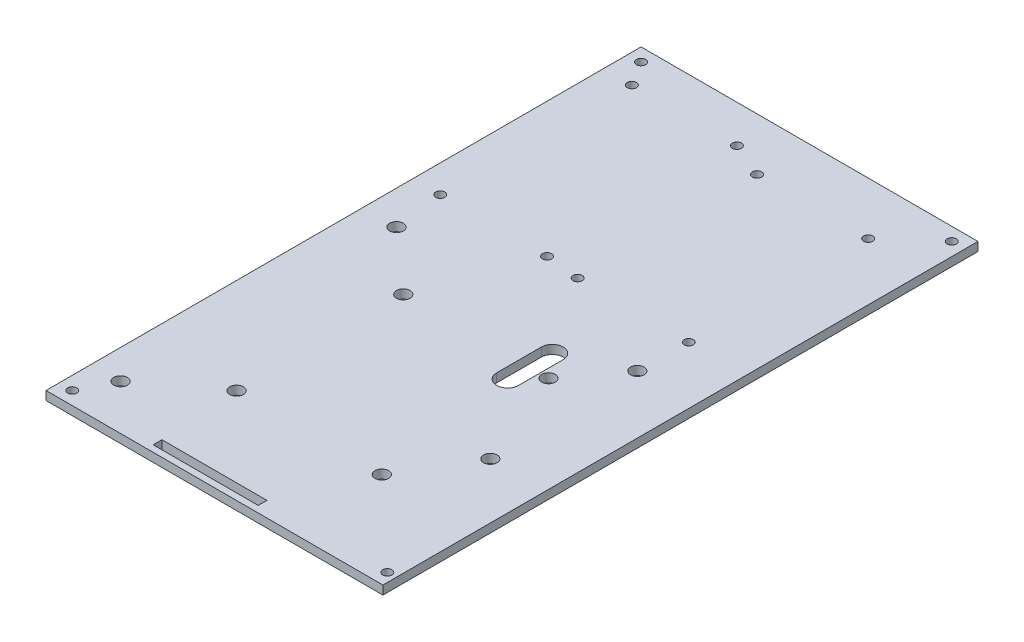
from build123d import *

# Parameters (mm, degrees)
SKETCH_1_W      = 77
SKETCH_1_H      = 136
SKETCH_1_R      = 1.55
SKETCH_1_R_2    = 1.05
SKETCH_1_W_2    = 24
SKETCH_1_H_2    = 2
EXTRUDE_1_DEPTH = 2


with BuildPart() as part:
    # 草图1 → 凸台-拉伸1 (new body)
    with BuildSketch(Plane(origin=(0, 0, 0), x_dir=(1, 0, 0), z_dir=(0, 1, 0))):
        with Locations((38.5, 68)):
            Rectangle(SKETCH_1_W, SKETCH_1_H)
        with Locations(Location((7.71, 72.38, 0), (0, 0, 270))):
            Circle(SKETCH_1_R, mode=Mode.SUBTRACT)
        with Locations(Location((6.71, 10.34, 0), (0, 0, 270))):
            Circle(SKETCH_1_R, mode=Mode.SUBTRACT)
        with Locations(Location((63.71, 71.44, 0), (0, 0, 270))):
            Circle(SKETCH_1_R, mode=Mode.SUBTRACT)
        with Locations(Location((64.31, 37.24, 0), (0, 0, 270))):
            Circle(SKETCH_1_R, mode=Mode.SUBTRACT)
        with Locations(Location((21.81, 21.74, 0), (0, 0, 270))):
            Circle(SKETCH_1_R, mode=Mode.SUBTRACT)
        with Locations(Location((55.01, 21.74, 0), (0, 0, 270))):
            Circle(SKETCH_1_R, mode=Mode.SUBTRACT)
        with Locations(Location((21.81, 59.84, 0), (0, 0, 270))):
            Circle(SKETCH_1_R, mode=Mode.SUBTRACT)
        with Locations(Location((55.01, 59.84, 0), (0, 0, 270))):
            Circle(SKETCH_1_R, mode=Mode.SUBTRACT)
        with Locations(Location((6.5, 127.4, 0), (0, 0, 270))):
            Circle(SKETCH_1_R_2, mode=Mode.SUBTRACT)
        with Locations(Location((30.5, 127.4, 0), (0, 0, 270))):
            Circle(SKETCH_1_R_2, mode=Mode.SUBTRACT)
        with Locations(Location((6.3, 83.8, 0), (0, 0, 270))):
            Circle(SKETCH_1_R_2, mode=Mode.SUBTRACT)
        with Locations(Location((30.7, 83.8, 0), (0, 0, 270))):
            Circle(SKETCH_1_R_2, mode=Mode.SUBTRACT)
        with Locations(Location((38.5, 124, 0), (0, 0, 270))):
            Circle(SKETCH_1_R_2, mode=Mode.SUBTRACT)
        with Locations(Location((63.9, 124, 0), (0, 0, 270))):
            Circle(SKETCH_1_R_2, mode=Mode.SUBTRACT)
        with Locations(Location((38.5, 83, 0), (0, 0, 270))):
            Circle(SKETCH_1_R_2, mode=Mode.SUBTRACT)
        with Locations(Location((63.9, 83, 0), (0, 0, 270))):
            Circle(SKETCH_1_R_2, mode=Mode.SUBTRACT)
        with Locations(Location((3, 3, 0), (0, 0, 270))):
            Circle(SKETCH_1_R_2, mode=Mode.SUBTRACT)
        with Locations(Location((75, 3, 0), (0, 0, 270))):
            Circle(SKETCH_1_R_2, mode=Mode.SUBTRACT)
        with Locations(Location((3, 133, 0), (0, 0, 270))):
            Circle(SKETCH_1_R_2, mode=Mode.SUBTRACT)
        with Locations(Location((74, 133, 0), (0, 0, 270))):
            Circle(SKETCH_1_R_2, mode=Mode.SUBTRACT)
        with BuildLine():
            Line((53, 65.2), (53, 55))
            ThreePointArc((53, 55), (50.5, 52.5), (48, 55))
            Line((48, 55), (48, 65.2))
            ThreePointArc((48, 65.2), (50.5, 67.7), (53, 65.2))
        make_face(mode=Mode.SUBTRACT)
        with Locations((35, 2.5)):
            Rectangle(SKETCH_1_W_2, SKETCH_1_H_2, mode=Mode.SUBTRACT)
    extrude(amount=EXTRUDE_1_DEPTH)


solid = part.part
